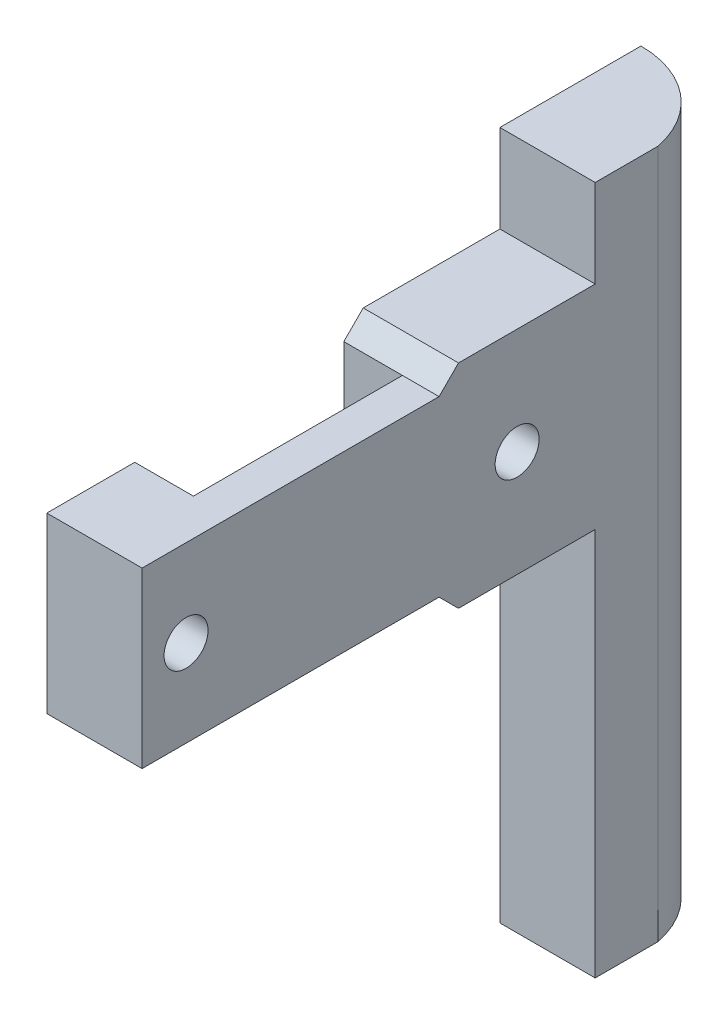
from build123d import *

# Parameters (mm, degrees)
SKETCH1_W                       = 21.3
SKETCH1_H                       = 29
BOSS_EXTRUDE1_DEPTH             = 25.87
CUT_EXTRUDE1_DEPTH              = 32.510782282
SKETCH5_W                       = 5
SKETCH5_H                       = 23.7
BOSS_EXTRUDE2_DEPTH             = 33.52
SKETCH6_W                       = 5
SKETCH6_H                       = 23.7
BOSS_EXTRUDE3_DEPTH             = 15.9
SKETCH7_W                       = 25.87
SKETCH7_H                       = 94
BOSS_EXTRUDE4_DEPTH             = 20
CUT_EXTRUDE2_DEPTH              = 108.033853523
SKETCH10_W                      = 25.87
SKETCH10_H                      = 23.7
BOSS_EXTRUDE5_DEPTH             = 7
F_6_0MM_CLEARANCE_DOWEL_HOLE1_D = 6
SKETCH13_W                      = 25.74
SKETCH13_H                      = 140
CUT_EXTRUDE3_DEPTH              = 109.61791657


with BuildPart() as part:
    # Sketch1 → Boss-Extrude1 (new body)
    with BuildSketch(Plane(origin=(0, 0, 0), x_dir=(0, 0, -1), z_dir=(1, 0, 0))):
        Rectangle(SKETCH1_W, SKETCH1_H)
    extrude(amount=BOSS_EXTRUDE1_DEPTH)

    # Sketch3 → Cut-Extrude1 (cut, through all)
    with BuildSketch(Plane(origin=(25.87, 0, 0), x_dir=(0, 0, -1), z_dir=(1, 0, 0))):
        Polygon((-7.998349571, -14.5), (-10.65, -11.848349571), (-10.65, -14.5), align=None)
        Polygon((-10.65, 11.848349571), (-10.65, 14.5), (-7.998349571, 14.5), align=None)
    extrude(amount=-CUT_EXTRUDE1_DEPTH, mode=Mode.SUBTRACT)

    # Sketch5 → Boss-Extrude2 (add)
    with BuildSketch(Plane.XY.offset(10.65)):
        with Locations((23.37, -0.001650429)):
            Rectangle(SKETCH5_W, SKETCH5_H)
        with Locations((2.5, -0.001650429)):
            Rectangle(SKETCH5_W, SKETCH5_H)
    extrude(amount=BOSS_EXTRUDE2_DEPTH)

    # Sketch6 → Boss-Extrude3 (add)
    with BuildSketch(Plane.ZY.offset(-20.87)):
        with Locations((41.67, -0.001650429)):
            Rectangle(SKETCH6_W, SKETCH6_H)
    extrude(amount=BOSS_EXTRUDE3_DEPTH)

    # Sketch7 → Boss-Extrude4 (add)
    with BuildSketch(Plane(origin=(0, 0, -10.65), x_dir=(-1, 0, 0), z_dir=(0, 0, -1))):
        with Locations((-12.935, -20.5)):
            Rectangle(SKETCH7_W, SKETCH7_H)
    extrude(amount=BOSS_EXTRUDE4_DEPTH)

    # Sketch9 → Cut-Extrude2 (cut, through all)
    with BuildSketch(Plane(origin=(0, -67.5, 0), x_dir=(-1, 0, 0), z_dir=(0, -1, 0))):
        with BuildLine():
            ThreePointArc((-26.12, 16.65), (-12.87, 29.9), (0.38, 16.65))
            Line((0.38, 16.65), (0.38, 30.65))
            Line((0.38, 30.65), (-26.12, 30.65))
            Line((-26.12, 30.65), (-26.12, 16.65))
        make_face()
    extrude(amount=-CUT_EXTRUDE2_DEPTH, mode=Mode.SUBTRACT)

    # Sketch10 → Boss-Extrude5 (add)
    with BuildSketch(Plane.XY.offset(44.17)):
        with Locations((12.935, -0.001650429)):
            Rectangle(SKETCH10_W, SKETCH10_H)
    extrude(amount=BOSS_EXTRUDE5_DEPTH)

    # Ø6.0mm Clearance Dowel Hole1 (through all)
    with Locations(Plane(origin=(25.87, 0, 0), x_dir=(0, 0, -1), z_dir=(1, 0, 0))):
        with Locations((-45.17, 0), (0, 0)):
            Hole(F_6_0MM_CLEARANCE_DOWEL_HOLE1_D / 2)

    # Sketch13 → Cut-Extrude3 (cut, through all)
    with BuildSketch(Plane.XY.offset(51.17)):
        with Locations((0, -0.001650429)):
            Rectangle(SKETCH13_W, SKETCH13_H)
    extrude(amount=-CUT_EXTRUDE3_DEPTH, mode=Mode.SUBTRACT)


solid = part.part
